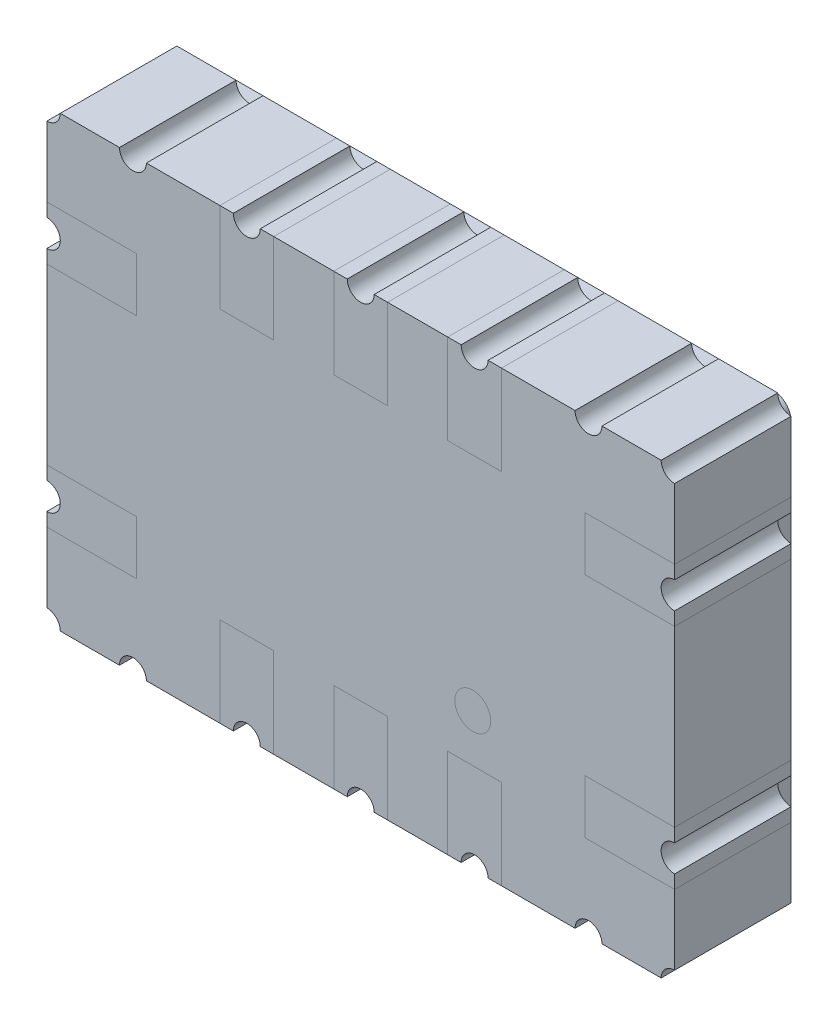
from build123d import *

# Parameters (mm, degrees)
SKETCH1_W              = 7
SKETCH1_H              = 5
BOSS_EXTRUDE1_DEPTH    = 1.5
CUT_EXTRUDE1_DEPTH     = 1.5
MIRROR2_COPY_1_DEPTH   = 1.5
SKETCH3_W              = 0.6
SKETCH3_H              = 1
SKETCH3_W_2            = 1
SKETCH3_H_2            = 0.6
CUT_EXTRUDE2_DEPTH     = 1.3
BOSS_EXTRUDE2_DEPTH    = 1.3
BOSS_EXTRUDE2_2_DEPTH  = 1.3
BOSS_EXTRUDE2_3_DEPTH  = 1.3
BOSS_EXTRUDE2_4_DEPTH  = 1.3
BOSS_EXTRUDE2_5_DEPTH  = 1.3
BOSS_EXTRUDE2_6_DEPTH  = 1.3
BOSS_EXTRUDE2_7_DEPTH  = 1.3
BOSS_EXTRUDE2_8_DEPTH  = 1.3
BOSS_EXTRUDE2_9_DEPTH  = 1.3
BOSS_EXTRUDE2_10_DEPTH = 1.3
SKETCH4_R              = 0.2
CUT_EXTRUDE3_DEPTH     = 1.3
SKETCH4_3_R            = 0.2
BOSS_EXTRUDE3_DEPTH    = 1.3
SKETCH5_R              = 0.3
CUT_EXTRUDE4_DEPTH     = 0.1
LPATTERN1_COUNT        = 6
LPATTERN1_PITCH        = 1
CUT_EXTRUDE5_START     = -0.2
SKETCH6_W              = 6.6
SKETCH6_H              = 4.6
CUT_EXTRUDE5_DEPTH     = 0.2
FILLET1_R              = 0.2


with BuildPart() as part:
    # Sketch1 → Boss-Extrude1 (new body)
    with BuildSketch(Plane.XY):
        Rectangle(SKETCH1_W, SKETCH1_H)
    extrude(amount=BOSS_EXTRUDE1_DEPTH)

    # Sketch2 → Cut-Extrude1 (cut)
    with BuildSketch(Plane.XY.offset(1.5)):
        with BuildLine():
            Line((-3.5, -2.35), (-3.5, -2.5))
            Line((-3.5, -2.5), (-3.35, -2.5))
            ThreePointArc((-3.35, -2.5), (-3.393933983, -2.393933983), (-3.5, -2.35))
        make_face()
    cut_extrude1 = extrude(amount=-CUT_EXTRUDE1_DEPTH, mode=Mode.SUBTRACT)

    # Mirror1: Cut-Extrude1 across plane
    add(cut_extrude1.mirror(Plane.ZX), mode=Mode.SUBTRACT)

    # Mirror2: Cut-Extrude1 across plane
    add(cut_extrude1.mirror(Plane(origin=(0, 0, 0), x_dir=(0, 0, 1), z_dir=(1, 0, 0))), mode=Mode.SUBTRACT)

    # Mirror2 copy 1 sketch → Mirror2 copy 1 (cut)
    with BuildSketch(Plane(origin=(0, 0, 1.5), x_dir=(-1, 0, 0), z_dir=(0, 0, 1))):
        with BuildLine():
            Line((-3.5, -2.35), (-3.5, -2.5))
            Line((-3.5, -2.5), (-3.35, -2.5))
            ThreePointArc((-3.35, -2.5), (-3.393933983, -2.393933983), (-3.5, -2.35))
        make_face()
    extrude(amount=-MIRROR2_COPY_1_DEPTH, mode=Mode.SUBTRACT)

    # Sketch3 → Cut-Extrude2 (cut)
    with BuildSketch(Plane.XY.offset(1.5)):
        with Locations((-1.27, -2)):
            Rectangle(SKETCH3_W, SKETCH3_H)
        with BuildLine():
            ThreePointArc((2.69, -2.5), (2.54, -2.35), (2.39, -2.5))
            Line((2.39, -2.5), (2.69, -2.5))
        make_face()
        with Locations((1.27, -2)):
            Rectangle(SKETCH3_W, SKETCH3_H)
        with Locations((0, -2)):
            Rectangle(SKETCH3_W, SKETCH3_H)
        with BuildLine():
            Line((-2.69, -2.5), (-2.39, -2.5))
            ThreePointArc((-2.39, -2.5), (-2.54, -2.35), (-2.69, -2.5))
        make_face()
        with BuildLine():
            ThreePointArc((-2.69, 2.5), (-2.54, 2.35), (-2.39, 2.5))
            Line((-2.39, 2.5), (-2.69, 2.5))
        make_face()
        with Locations((-1.27, 2)):
            Rectangle(SKETCH3_W, SKETCH3_H)
        with Locations((0, 2)):
            Rectangle(SKETCH3_W, SKETCH3_H)
        with Locations((1.27, 2)):
            Rectangle(SKETCH3_W, SKETCH3_H)
        with BuildLine():
            Line((2.69, 2.5), (2.39, 2.5))
            ThreePointArc((2.39, 2.5), (2.54, 2.35), (2.69, 2.5))
        make_face()
        with Locations((-3, -1.27)):
            Rectangle(SKETCH3_W_2, SKETCH3_H_2)
        with Locations((-3, 1.27)):
            Rectangle(SKETCH3_W_2, SKETCH3_H_2)
        with Locations((3, 1.27)):
            Rectangle(SKETCH3_W_2, SKETCH3_H_2)
        with Locations((3, -1.27)):
            Rectangle(SKETCH3_W_2, SKETCH3_H_2)
    extrude(amount=-CUT_EXTRUDE2_DEPTH, mode=Mode.SUBTRACT)

    # Sketch4 → Cut-Extrude3 (cut)
    with BuildSketch(Plane.XY.offset(1.5)):
        with Locations((1.25, -0.97)):
            Circle(SKETCH4_R)
    extrude(amount=-CUT_EXTRUDE3_DEPTH, mode=Mode.SUBTRACT)

    # Sketch5 → Cut-Extrude4 (cut)
    with BuildSketch(Plane(origin=(0, 0, 0), x_dir=(-1, 0, 0), z_dir=(0, 0, -1))):
        with Locations((2.5, 1)):
            Circle(SKETCH5_R)
        with Locations((2.5, 0)):
            Circle(SKETCH5_R)
        with Locations((2.5, -1)):
            Circle(SKETCH5_R)
    cut_extrude4 = extrude(amount=-CUT_EXTRUDE4_DEPTH, mode=Mode.SUBTRACT)

    # LPattern1: Cut-Extrude4 ×6
    with Locations(*[(i * LPATTERN1_PITCH, 0, 0) for i in range(1, LPATTERN1_COUNT)]):
        add(cut_extrude4, mode=Mode.SUBTRACT)

    # Sketch6 → Cut-Extrude5 (cut)
    with BuildSketch(Plane(origin=(0, 0, 0), x_dir=(-1, 0, 0), z_dir=(0, 0, -1)).offset(CUT_EXTRUDE5_START)):
        with BuildLine():
            Line((3.5, 2.35), (3.5, -2.35))
            ThreePointArc((3.5, -2.35), (3.393933983, -2.393933983), (3.35, -2.5))
            Line((3.35, -2.5), (-3.35, -2.5))
            ThreePointArc((-3.35, -2.5), (-3.393933983, -2.393933983), (-3.5, -2.35))
            Line((-3.5, -2.35), (-3.5, 2.35))
            ThreePointArc((-3.5, 2.35), (-3.393933983, 2.393933983), (-3.35, 2.5))
            Line((-3.35, 2.5), (3.35, 2.5))
            ThreePointArc((3.35, 2.5), (3.393933983, 2.393933983), (3.5, 2.35))
        make_face()
        Rectangle(SKETCH6_W, SKETCH6_H, mode=Mode.SUBTRACT)
    extrude(amount=CUT_EXTRUDE5_DEPTH, mode=Mode.SUBTRACT)

    # Fillet1
    fillet1_edges = [part.edges().sort_by_distance(p)[0] for p in [
        (-3.3, 2.3, 0.1),
        (-3.3, -2.3, 0.1),
        (3.3, -2.3, 0.1),
        (3.3, 2.3, 0.1),
    ]]
    fillet(fillet1_edges, radius=FILLET1_R)


with BuildPart() as body_2:
    # Sketch3<3> → Boss-Extrude2 (new body)
    with BuildSketch(Plane.XY.offset(1.5)):
        with BuildLine():
            Line((-1.57, -1.5), (-1.57, -2.5))
            Line((-1.57, -2.5), (-1.42, -2.5))
            ThreePointArc((-1.42, -2.5), (-1.27, -2.35), (-1.12, -2.5))
            Line((-1.12, -2.5), (-0.97, -2.5))
            Line((-0.97, -2.5), (-0.97, -1.5))
            Line((-0.97, -1.5), (-1.57, -1.5))
        make_face()
    extrude(amount=-BOSS_EXTRUDE2_DEPTH)


with BuildPart() as body_3:
    # Sketch3<3> → Boss-Extrude2 2 (new body)
    with BuildSketch(Plane.XY.offset(1.5)):
        with BuildLine():
            Line((0.97, -1.5), (0.97, -2.5))
            Line((0.97, -2.5), (1.12, -2.5))
            ThreePointArc((1.12, -2.5), (1.27, -2.35), (1.42, -2.5))
            Line((1.42, -2.5), (1.57, -2.5))
            Line((1.57, -2.5), (1.57, -1.5))
            Line((1.57, -1.5), (0.97, -1.5))
        make_face()
    extrude(amount=-BOSS_EXTRUDE2_2_DEPTH)


with BuildPart() as body_4:
    # Sketch3<3> → Boss-Extrude2 3 (new body)
    with BuildSketch(Plane.XY.offset(1.5)):
        with BuildLine():
            Line((-0.3, -1.5), (-0.3, -2.5))
            Line((-0.3, -2.5), (-0.15, -2.5))
            ThreePointArc((-0.15, -2.5), (0, -2.35), (0.15, -2.5))
            Line((0.15, -2.5), (0.3, -2.5))
            Line((0.3, -2.5), (0.3, -1.5))
            Line((0.3, -1.5), (-0.3, -1.5))
        make_face()
    extrude(amount=-BOSS_EXTRUDE2_3_DEPTH)


with BuildPart() as body_5:
    # Sketch3<3> → Boss-Extrude2 4 (new body)
    with BuildSketch(Plane.XY.offset(1.5)):
        with BuildLine():
            Line((-0.97, 1.5), (-0.97, 2.5))
            Line((-0.97, 2.5), (-1.12, 2.5))
            ThreePointArc((-1.12, 2.5), (-1.27, 2.35), (-1.42, 2.5))
            Line((-1.42, 2.5), (-1.57, 2.5))
            Line((-1.57, 2.5), (-1.57, 1.5))
            Line((-1.57, 1.5), (-0.97, 1.5))
        make_face()
    extrude(amount=-BOSS_EXTRUDE2_4_DEPTH)


with BuildPart() as body_6:
    # Sketch3<3> → Boss-Extrude2 5 (new body)
    with BuildSketch(Plane.XY.offset(1.5)):
        with BuildLine():
            Line((0.3, 1.5), (0.3, 2.5))
            Line((0.3, 2.5), (0.15, 2.5))
            ThreePointArc((0.15, 2.5), (0, 2.35), (-0.15, 2.5))
            Line((-0.15, 2.5), (-0.3, 2.5))
            Line((-0.3, 2.5), (-0.3, 1.5))
            Line((-0.3, 1.5), (0.3, 1.5))
        make_face()
    extrude(amount=-BOSS_EXTRUDE2_5_DEPTH)


with BuildPart() as body_7:
    # Sketch3<3> → Boss-Extrude2 6 (new body)
    with BuildSketch(Plane.XY.offset(1.5)):
        with BuildLine():
            Line((1.57, 1.5), (1.57, 2.5))
            Line((1.57, 2.5), (1.42, 2.5))
            ThreePointArc((1.42, 2.5), (1.27, 2.35), (1.12, 2.5))
            Line((1.12, 2.5), (0.97, 2.5))
            Line((0.97, 2.5), (0.97, 1.5))
            Line((0.97, 1.5), (1.57, 1.5))
        make_face()
    extrude(amount=-BOSS_EXTRUDE2_6_DEPTH)


with BuildPart() as body_8:
    # Sketch3<3> → Boss-Extrude2 7 (new body)
    with BuildSketch(Plane.XY.offset(1.5)):
        with BuildLine():
            Line((-2.5, -0.97), (-3.5, -0.97))
            Line((-3.5, -0.97), (-3.5, -1.12))
            ThreePointArc((-3.5, -1.12), (-3.35, -1.27), (-3.5, -1.42))
            Line((-3.5, -1.42), (-3.5, -1.57))
            Line((-3.5, -1.57), (-2.5, -1.57))
            Line((-2.5, -1.57), (-2.5, -0.97))
        make_face()
    extrude(amount=-BOSS_EXTRUDE2_7_DEPTH)


with BuildPart() as body_9:
    # Sketch3<3> → Boss-Extrude2 8 (new body)
    with BuildSketch(Plane.XY.offset(1.5)):
        with BuildLine():
            Line((-2.5, 1.57), (-3.5, 1.57))
            Line((-3.5, 1.57), (-3.5, 1.42))
            ThreePointArc((-3.5, 1.42), (-3.35, 1.27), (-3.5, 1.12))
            Line((-3.5, 1.12), (-3.5, 0.97))
            Line((-3.5, 0.97), (-2.5, 0.97))
            Line((-2.5, 0.97), (-2.5, 1.57))
        make_face()
    extrude(amount=-BOSS_EXTRUDE2_8_DEPTH)


with BuildPart() as body_10:
    # Sketch3<3> → Boss-Extrude2 9 (new body)
    with BuildSketch(Plane.XY.offset(1.5)):
        with BuildLine():
            Line((3.5, 1.57), (2.5, 1.57))
            Line((2.5, 1.57), (2.5, 0.97))
            Line((2.5, 0.97), (3.5, 0.97))
            Line((3.5, 0.97), (3.5, 1.12))
            ThreePointArc((3.5, 1.12), (3.35, 1.27), (3.5, 1.42))
            Line((3.5, 1.42), (3.5, 1.57))
        make_face()
    extrude(amount=-BOSS_EXTRUDE2_9_DEPTH)


with BuildPart() as body_11:
    # Sketch3<3> → Boss-Extrude2 10 (new body)
    with BuildSketch(Plane.XY.offset(1.5)):
        with BuildLine():
            Line((3.5, -1.12), (3.5, -0.97))
            Line((3.5, -0.97), (2.5, -0.97))
            Line((2.5, -0.97), (2.5, -1.57))
            Line((2.5, -1.57), (3.5, -1.57))
            Line((3.5, -1.57), (3.5, -1.42))
            ThreePointArc((3.5, -1.42), (3.35, -1.27), (3.5, -1.12))
        make_face()
    extrude(amount=-BOSS_EXTRUDE2_10_DEPTH)


with BuildPart() as body_12:
    # Sketch4<3> → Boss-Extrude3 (new body)
    with BuildSketch(Plane.XY.offset(1.5)):
        with Locations((1.25, -0.97)):
            Circle(SKETCH4_3_R)
    extrude(amount=-BOSS_EXTRUDE3_DEPTH)


solid = Compound([part.part, body_2.part, body_3.part, body_4.part, body_5.part, body_6.part, body_7.part, body_8.part, body_9.part, body_10.part, body_11.part, body_12.part])
